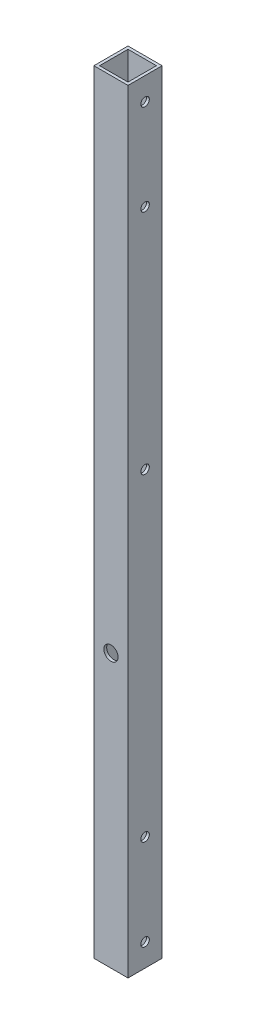
from build123d import *

# Parameters (mm, degrees)
SKETCH1_W               = 19.05
SKETCH1_H               = 19.05
SKETCH1_W_2             = 15.875
SKETCH1_H_2             = 15.875
BOSS_EXTRUDE1_DEPTH     = 431.8
CUT_EXTRUDE1_REACH      = 434.325
SKETCH2_R               = 3.96875
CUT_EXTRUDE2_DEPTH      = 433.0100592
CUT_EXTRUDE2_DEPTH_BACK = 433.0100592
SKETCH3_R               = 2.38125


with BuildPart() as part:
    # Sketch1 → Boss-Extrude1 (new body)
    with BuildSketch(Plane(origin=(0, 0, 0), x_dir=(1, 0, 0), z_dir=(0, 1, 0))):
        Rectangle(SKETCH1_W, SKETCH1_H)
        Rectangle(SKETCH1_W_2, SKETCH1_H_2, mode=Mode.SUBTRACT)
    extrude(amount=BOSS_EXTRUDE1_DEPTH)

    # Sketch2 → Cut-Extrude1 (cut, up to next)
    with BuildSketch(Plane.XY.offset(9.525), mode=Mode.PRIVATE) as cut_extrude1_sk1:
        with Locations((0, 152.4)):
            Circle(SKETCH2_R)
    cut_extrude1_tool1 = extrude(cut_extrude1_sk1.sketch, amount=-CUT_EXTRUDE1_REACH, mode=Mode.PRIVATE) & part.part
    add(cut_extrude1_tool1.solids().sort_by_distance((0, 152.4, 9.525))[0], mode=Mode.SUBTRACT)

    # Sketch3 → Cut-Extrude2 (cut, two sides: drawn at the far end of the back side and taken through both)
    with BuildSketch(Plane(origin=(0, 0, 0), x_dir=(0, 0, -1), z_dir=(1, 0, 0)).offset(-CUT_EXTRUDE2_DEPTH_BACK)):
        with Locations((0, 12.7)):
            Circle(SKETCH3_R)
        with Locations((0, 63.5)):
            Circle(SKETCH3_R)
        with Locations((0, 241.3)):
            Circle(SKETCH3_R)
        with Locations((0, 368.3)):
            Circle(SKETCH3_R)
        with Locations((0, 419.1)):
            Circle(SKETCH3_R)
    extrude(amount=CUT_EXTRUDE2_DEPTH + CUT_EXTRUDE2_DEPTH_BACK, mode=Mode.SUBTRACT)


solid = part.part
